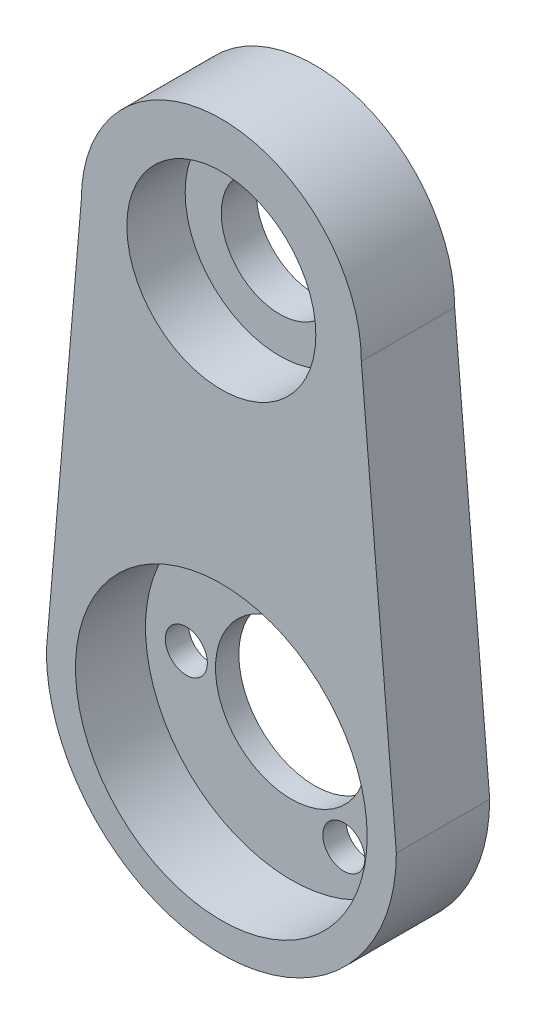
from build123d import *

# Parameters (mm, degrees)
BOSS_EXTRU_1_DEPTH      = 8
ESQUISSE2_R             = 6.5
ENL_V_MAT_EXTRU_1_DEPTH = 10
ESQUISSE3_R             = 1.8
ENL_V_MAT_EXTRU_2_DEPTH = 10
ESQUISSE5_R             = 12.5
ENL_V_MAT_EXTRU_5_DEPTH = 6
ESQUISSE19_R            = 8.1
ENL_V_MAT_EXTRU_6_DEPTH = 10
BOSS_EXTRU_2_START      = -3
ESQUISSE22_R            = 8.1
ESQUISSE22_R_2          = 5
BOSS_EXTRU_2_DEPTH      = 3


with BuildPart() as part:
    # Esquisse1 → Boss.-Extru.1 (new body)
    with BuildSketch(Plane.XY):
        with BuildLine():
            Line((12, 0), (15, -35))
            ThreePointArc((15, -35), (0, -50), (-15, -35))
            Line((-15, -35), (-12, 0))
            ThreePointArc((-12, 0), (0, 12), (12, 0))
        make_face()
    extrude(amount=BOSS_EXTRU_1_DEPTH)

    # Esquisse2 → Enlèv. mat.-Extru.1 (cut)
    with BuildSketch(Plane.XY.offset(8)):
        with Locations((0, -35)):
            Circle(ESQUISSE2_R)
    extrude(amount=-ENL_V_MAT_EXTRU_1_DEPTH, mode=Mode.SUBTRACT)

    # Esquisse3 → Enlèv. mat.-Extru.2 (cut)
    with BuildSketch(Plane.XY.offset(8)):
        with Locations((4.5, -42.794228634)):
            Circle(ESQUISSE3_R)
        with Locations((-9, -35)):
            Circle(ESQUISSE3_R)
        with Locations((4.5, -27.205771366)):
            Circle(ESQUISSE3_R)
    extrude(amount=-ENL_V_MAT_EXTRU_2_DEPTH, mode=Mode.SUBTRACT)

    # Esquisse5 → Enlèv. mat.-Extru.5 (cut)
    with BuildSketch(Plane.XY.offset(8)):
        with Locations((0, -35)):
            Circle(ESQUISSE5_R)
    extrude(amount=-ENL_V_MAT_EXTRU_5_DEPTH, mode=Mode.SUBTRACT)

    # Esquisse19 → Enlèv. mat.-Extru.6 (cut)
    with BuildSketch(Plane.XY.offset(8)):
        Circle(ESQUISSE19_R)
    extrude(amount=-ENL_V_MAT_EXTRU_6_DEPTH, mode=Mode.SUBTRACT)

    # Esquisse22 → Boss.-Extru.2 (add)
    with BuildSketch(Plane(origin=(0, 0, 0), x_dir=(-1, 0, 0), z_dir=(0, 0, -1)).offset(BOSS_EXTRU_2_START)):
        with Locations(Location((0, 0, 0), (0, 0, 180))):
            Circle(ESQUISSE22_R)
        Circle(ESQUISSE22_R_2, mode=Mode.SUBTRACT)
    extrude(amount=BOSS_EXTRU_2_DEPTH)


solid = part.part
